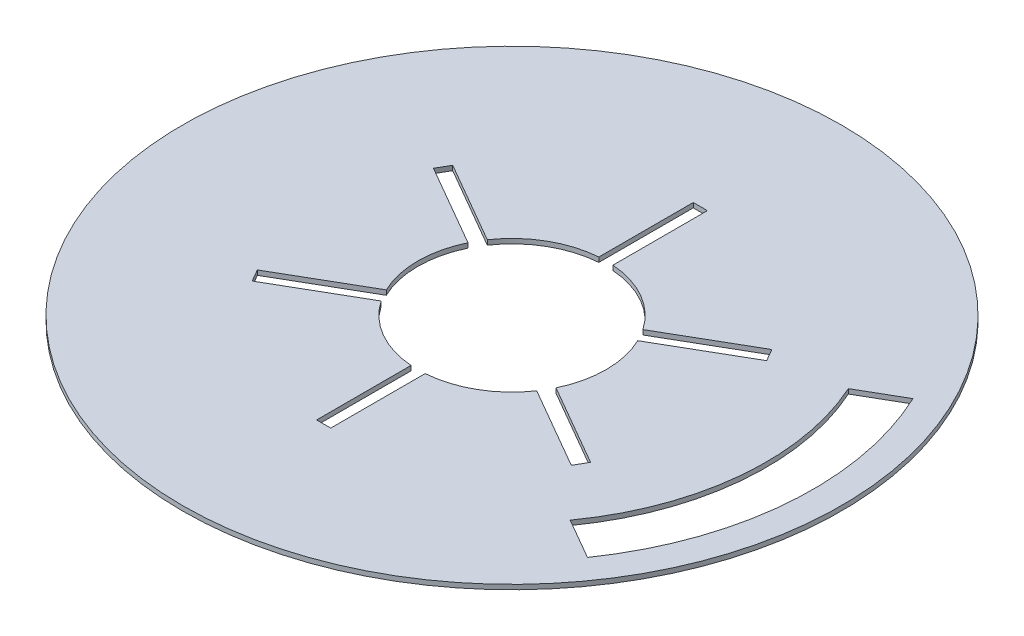
from build123d import *

# Parameters (mm, degrees)
IZIM1_R                     = 350
Y_KSEKLIK_EKSTR_ZYON1_DEPTH = 5


with BuildPart() as part:
    # Çizim1 → Yükseklik-Ekstrüzyon1 (new body)
    with BuildSketch(Plane(origin=(0, 0, 0), x_dir=(1, 0, 0), z_dir=(0, 1, 0))):
        with Locations(Location((0, 0, 0), (0, 0, 270))):
            Circle(IZIM1_R)
        with BuildLine():
            Line((82.608627247, 56.354367216), (169.455080757, 106.495190528))
            Line((169.455080757, 106.495190528), (176.955080757, 93.504809472))
            Line((176.955080757, 93.504809472), (90.108627247, 43.36398616))
            ThreePointArc((90.108627247, 43.36398616), (100, 0), (90.108627247, -43.36398616))
            Line((90.108627247, -43.36398616), (176.955080757, -93.504809472))
            Line((176.955080757, -93.504809472), (169.455080757, -106.495190528))
            Line((169.455080757, -106.495190528), (82.608627247, -56.354367216))
            ThreePointArc((82.608627247, -56.354367216), (50, -86.602540378), (7.5, -99.718353376))
            Line((7.5, -99.718353376), (7.5, -200))
            Line((7.5, -200), (-7.5, -200))
            Line((-7.5, -200), (-7.5, -99.718353376))
            ThreePointArc((-7.5, -99.718353376), (-50, -86.602540378), (-82.608627247, -56.354367216))
            Line((-82.608627247, -56.354367216), (-169.455080757, -106.495190528))
            Line((-169.455080757, -106.495190528), (-176.955080757, -93.504809472))
            Line((-176.955080757, -93.504809472), (-90.108627247, -43.36398616))
            ThreePointArc((-90.108627247, -43.36398616), (-100, 0), (-90.108627247, 43.36398616))
            Line((-90.108627247, 43.36398616), (-176.955080757, 93.504809472))
            Line((-176.955080757, 93.504809472), (-169.455080757, 106.495190528))
            Line((-169.455080757, 106.495190528), (-82.608627247, 56.354367216))
            ThreePointArc((-82.608627247, 56.354367216), (-50, 86.602540378), (-7.5, 99.718353376))
            Line((-7.5, 99.718353376), (-7.5, 200))
            Line((-7.5, 200), (7.5, 200))
            Line((7.5, 200), (7.5, 99.718353376))
            ThreePointArc((7.5, 99.718353376), (50, 86.602540378), (82.608627247, 56.354367216))
        make_face(mode=Mode.SUBTRACT)
        with BuildLine():
            Line((246.056268189, 111.158953237), (289.538139145, 136.263223139))
            ThreePointArc((289.538139145, 136.263223139), (318.878995434, -26.761656733), (262.776482412, -182.615772295))
            Line((262.776482412, -182.615772295), (219.294611456, -157.511502394))
            ThreePointArc((219.294611456, -157.511502394), (268.670455631, -26.761656733), (246.056268189, 111.158953237))
        make_face(mode=Mode.SUBTRACT)
    extrude(amount=Y_KSEKLIK_EKSTR_ZYON1_DEPTH)


solid = part.part
